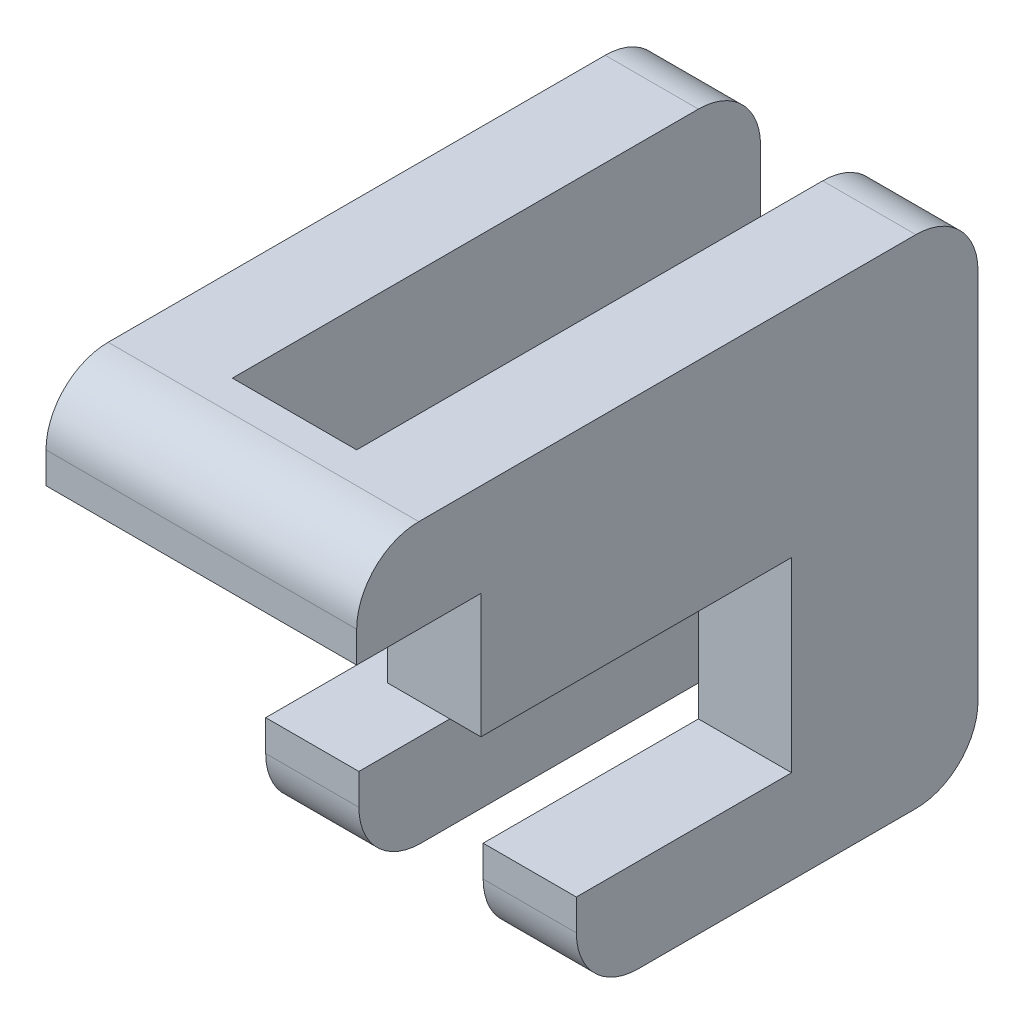
from build123d import *

# Parameters (mm, degrees)
EXTRUDE_1_DEPTH     = 10
SKETCH_2_W          = 4
SKETCH_2_H          = 17
CUT_EXTRUDE_1_DEPTH = 28.49545417


with BuildPart() as part:
    # 草图1 → 凸台-拉伸1 (new body)
    with BuildSketch(Plane(origin=(0, 0, 0), x_dir=(0, 0, -1), z_dir=(1, 0, 0))):
        with BuildLine():
            Line((2, 0), (18, 0))
            ThreePointArc((18, 0), (19.414213562, -0.585786438), (20, -2))
            Line((20, -2), (20, -14))
            ThreePointArc((20, -14), (19.414213562, -15.414213562), (18, -16))
            Line((18, -16), (9.071485189, -16))
            ThreePointArc((9.071485189, -16), (7.657271627, -15.414213562), (7.071485189, -14))
            Line((7.071485189, -14), (7.071485189, -13))
            Line((7.071485189, -13), (14, -13))
            Line((14, -13), (14, -7))
            Line((14, -7), (4, -7))
            Line((4, -7), (4, -3))
            Line((4, -3), (0, -3))
            Line((0, -3), (0, -2))
            ThreePointArc((0, -2), (0.585786438, -0.585786438), (2, 0))
        make_face()
    extrude(amount=EXTRUDE_1_DEPTH)

    # 草图2 → 切除-拉伸1 (cut, through all)
    with BuildSketch(Plane(origin=(0, 0, 0), x_dir=(1, 0, 0), z_dir=(0, 1, 0))):
        with Locations((5, 11.5)):
            Rectangle(SKETCH_2_W, SKETCH_2_H)
    extrude(amount=-CUT_EXTRUDE_1_DEPTH, mode=Mode.SUBTRACT)


solid = part.part
